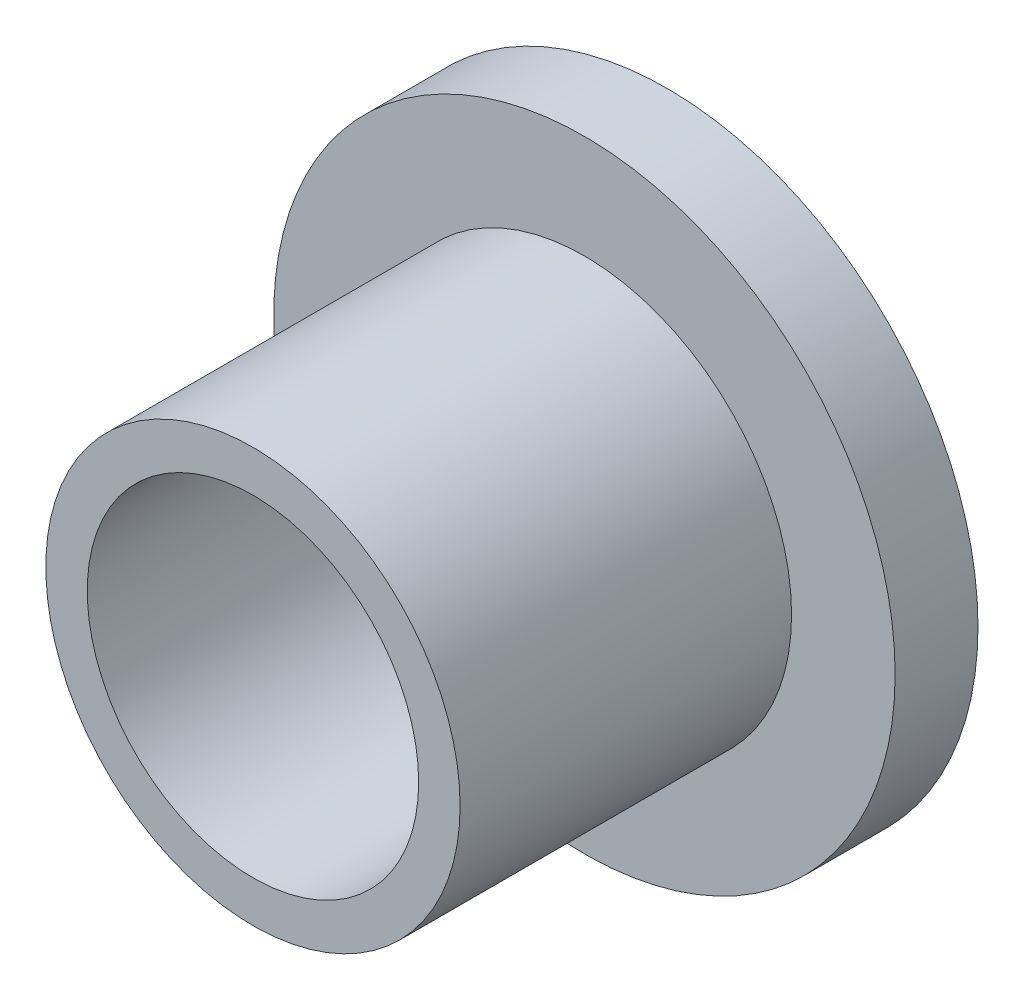
from build123d import *

# Parameters (mm, degrees)
SKETCH1_R           = 5
SKETCH1_R_2         = 4
BOSS_EXTRUDE1_DEPTH = 10
SKETCH1_3_R         = 7.5
SKETCH1_3_R_2       = 5
BOSS_EXTRUDE2_DEPTH = 2


with BuildPart() as part:
    # Sketch1 → Boss-Extrude1 (new body)
    with BuildSketch(Plane.XY):
        Circle(SKETCH1_R)
        Circle(SKETCH1_R_2, mode=Mode.SUBTRACT)
    extrude(amount=BOSS_EXTRUDE1_DEPTH)

    # Sketch1<3> → Boss-Extrude2 (add)
    with BuildSketch(Plane.XY):
        Circle(SKETCH1_3_R)
        Circle(SKETCH1_3_R_2, mode=Mode.SUBTRACT)
    extrude(amount=BOSS_EXTRUDE2_DEPTH)


solid = part.part
